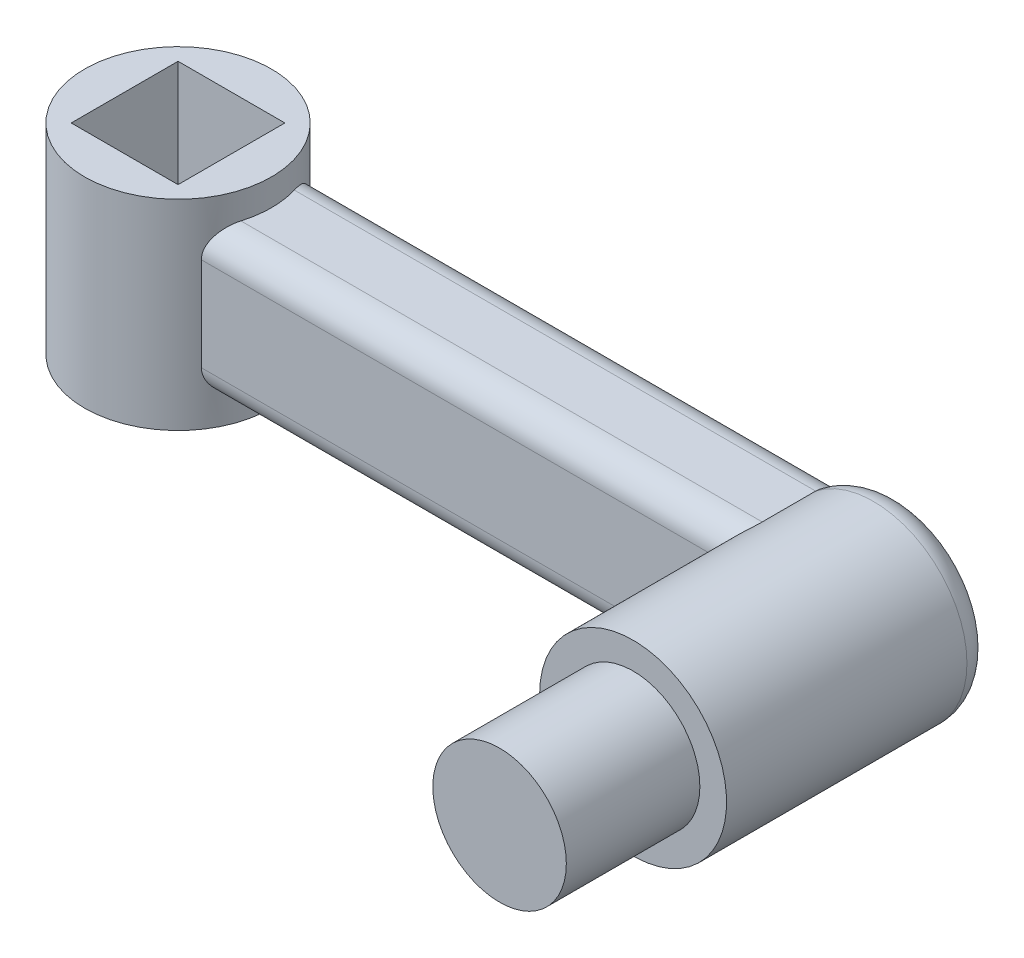
from build123d import *

# Parameters (mm, degrees)
SKETCH1_R           = 35
BOSS_EXTRUDE1_DEPTH = 75
SKETCH2_W           = 40
SKETCH2_H           = 40
CUT_EXTRUDE1_DEPTH  = 90.86100377805714
BOSS_EXTRUDE2_START = -10
BOSS_EXTRUDE2_DEPTH = 55
SKETCH5_R           = 35.00000000000001
BOSS_EXTRUDE3_DEPTH = 100
SKETCH8_R           = 25.000000000000007
BOSS_EXTRUDE5_DEPTH = 50
FILLET1_R           = 10
FILLET2_R           = 10


with BuildPart() as part:
    # Sketch1 → Boss-Extrude1 (new body)
    with BuildSketch(Plane(origin=(0, 0, 0), x_dir=(1, 0, 0), z_dir=(0, 1, 0))):
        with Locations(Location((0, 0, 0), (0, 0, 270))):
            Circle(SKETCH1_R)
    extrude(amount=BOSS_EXTRUDE1_DEPTH)

    # Sketch2 → Cut-Extrude1 (cut, through all)
    with BuildSketch(Plane(origin=(0, 75, 0), x_dir=(1, 0, 0), z_dir=(0, 1, 0))):
        Rectangle(SKETCH2_W, SKETCH2_H)
    extrude(amount=-CUT_EXTRUDE1_DEPTH, mode=Mode.SUBTRACT)

    # Sketch3 → Boss-Extrude2 (add)
    with BuildSketch(Plane(origin=(0, 75, 0), x_dir=(1, 0, 0), z_dir=(0, 1, 0)).offset(BOSS_EXTRUDE2_START)):
        Polygon((228.72281323269016, -19.99999999999999), (28.72281323269015, -20.000000000000014), (28.72281323269015, 19.999999999999982), (228.72281323269016, 20.00000000000001), align=None)
    extrude(amount=-BOSS_EXTRUDE2_DEPTH)

    # Sketch5 → Boss-Extrude3 (add)
    with BuildSketch(Plane(origin=(-2.78e-15, 0, -19.99999999999998), x_dir=(-1, 0, 1.4e-16), z_dir=(-1.4e-16, 0, -1))):
        with Locations((-250.37344832730113, 37.49999999999998)):
            Circle(SKETCH5_R)
    extrude(amount=-BOSS_EXTRUDE3_DEPTH)

    # Sketch8 → Boss-Extrude5 (add)
    with BuildSketch(Plane.XY.offset(80.00000000000003)):
        with Locations((250.37344832730113, 37.49999999999998)):
            Circle(SKETCH8_R)
    extrude(amount=BOSS_EXTRUDE5_DEPTH)

    # Fillet1
    fillet1_edges = [part.edges().sort_by_distance(p)[0] for p in [
        (128.72281323269016, 10, -19.999999999999996),
        (128.72281323269016, 10, 20.000000000000004),
        (128.72281323269016, 65, 20.000000000000004),
        (128.72281323269016, 65, -19.999999999999996),
    ]]
    fillet(fillet1_edges, radius=FILLET1_R)

    # Fillet2
    fillet2_edges = [part.edges().sort_by_distance(p)[0] for p in [
        (285.37344832730116, 37.49999999999991, -20.00000000000001),
    ]]
    fillet(fillet2_edges, radius=FILLET2_R)


with BuildPart() as part_1:
    # Body-Move/Copy1: moved
    add(part.part.moved(Location((-250, -37.5, 0))))


solid = part_1.part
